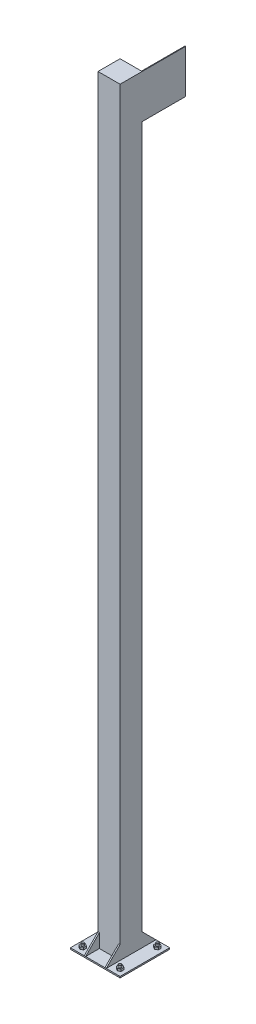
from build123d import *

# Parameters (mm, degrees)
CROQUIS1_W               = 101.6
CROQUIS1_H               = 101.6
CROQUIS1_W_2             = 95.6
CROQUIS1_H_2             = 95.6
SALIENTE_EXTRUIR1_DEPTH  = 3500
CROQUIS2_W               = 228.6
CROQUIS2_H               = 228.6
SALIENTE_EXTRUIR2_DEPTH  = 6.35
SALIENTE_EXTRUIR5_DEPTH  = 6.35
SALIENTE_EXTRUIR6_DEPTH  = 6.35
CROQUIS7_R               = 6.35
SALIENTE_EXTRUIR7_DEPTH  = 20
CROQUIS8_R               = 6.35
SALIENTE_EXTRUIR8_DEPTH  = 10
CHAFL_N1_SIZE            = 1
CROQUIS9_W               = 95.6
CROQUIS9_H               = 95.6
SALIENTE_EXTRUIR9_DEPTH  = 3
CROQUIS10_W              = 200
CROQUIS10_H              = 200
SALIENTE_EXTRUIR10_DEPTH = 3


with BuildPart() as part:
    # Croquis1 → Saliente-Extruir1 (new body)
    with BuildSketch(Plane(origin=(0, 0, 0), x_dir=(1, 0, 0), z_dir=(0, 1, 0))):
        with Locations((50.8, 50.8)):
            Rectangle(CROQUIS1_W, CROQUIS1_H)
        with Locations((50.8, 50.8)):
            Rectangle(CROQUIS1_W_2, CROQUIS1_H_2, mode=Mode.SUBTRACT)
    extrude(amount=SALIENTE_EXTRUIR1_DEPTH)

    # Croquis2 → Saliente-Extruir2 (add)
    with BuildSketch(Plane.XZ):
        with Locations((50.8, -50.8)):
            Rectangle(CROQUIS2_W, CROQUIS2_H)
    extrude(amount=-SALIENTE_EXTRUIR2_DEPTH)

    # Croquis5 → Saliente-Extruir5 (add)
    with BuildSketch(Plane.ZY):
        Polygon((-101.6, 6.35), (-165.1, 6.35), (-101.6, 69.85), align=None)
        Polygon((63.5, 6.35), (0, 6.35), (0, 69.85), align=None)
    extrude(amount=-SALIENTE_EXTRUIR5_DEPTH)

    # Croquis6 → Saliente-Extruir6 (add)
    with BuildSketch(Plane(origin=(101.6, 0, 0), x_dir=(0, 0, -1), z_dir=(1, 0, 0))):
        Polygon((0, 69.85), (-63.5, 6.35), (0, 6.35), align=None)
        Polygon((101.6, 69.85), (165.1, 6.35), (101.6, 6.35), align=None)
    extrude(amount=-SALIENTE_EXTRUIR6_DEPTH)

    # Croquis7 → Saliente-Extruir7 (add)
    with BuildSketch(Plane(origin=(0, 6.35, 0), x_dir=(1, 0, 0), z_dir=(0, 1, 0))):
        with Locations(Location((136.815728753, 136.815728753, 0), (0, 0, 90))):
            Circle(CROQUIS7_R)
        with Locations(Location((136.815728753, -35.215728753, 0), (0, 0, 90))):
            Circle(CROQUIS7_R)
        with Locations(Location((-35.215728753, -35.215728753, 0), (0, 0, 90))):
            Circle(CROQUIS7_R)
        with Locations(Location((-35.215728753, 136.815728753, 0), (0, 0, 90))):
            Circle(CROQUIS7_R)
    extrude(amount=SALIENTE_EXTRUIR7_DEPTH)

    # Croquis8 → Saliente-Extruir8 (add)
    # profile 1 of 4: a face of its own
    with BuildSketch(Plane(origin=(0, 6.35, 0), x_dir=(1, 0, 0), z_dir=(0, 1, 0))):
        Polygon((136.815728753, 124.195901838), (147.744819452, 130.505815295), (147.744819452, 143.12564221), (136.815728753, 149.435555667), (125.886638053, 143.12564221), (125.886638053, 130.505815295), align=None)
        with Locations(Location((136.815728753, 136.815728753, 0), (0, 0, 270))):
            Circle(CROQUIS8_R, mode=Mode.SUBTRACT)
    # profile 2 of 4: a face of its own
    with BuildSketch(Plane(origin=(0, 6.35, 0), x_dir=(1, 0, 0), z_dir=(0, 1, 0))):
        Polygon((125.886638053, -28.905815295), (136.815728753, -22.595901838), (147.744819452, -28.905815295), (147.744819452, -41.52564221), (136.815728753, -47.835555667), (125.886638053, -41.52564221), align=None)
        with Locations(Location((136.815728753, -35.215728753, 0), (0, 0, 90))):
            Circle(CROQUIS8_R, mode=Mode.SUBTRACT)
    # profile 3 of 4: a face of its own
    with BuildSketch(Plane(origin=(0, 6.35, 0), x_dir=(1, 0, 0), z_dir=(0, 1, 0))):
        Polygon((-35.215728753, -22.595901838), (-46.144819452, -28.905815295), (-46.144819452, -41.52564221), (-35.215728753, -47.835555667), (-24.286638053, -41.52564221), (-24.286638053, -28.905815295), align=None)
        with Locations(Location((-35.215728753, -35.215728753, 0), (0, 0, 270))):
            Circle(CROQUIS8_R, mode=Mode.SUBTRACT)
    # profile 4 of 4: a face of its own
    with BuildSketch(Plane(origin=(0, 6.35, 0), x_dir=(1, 0, 0), z_dir=(0, 1, 0))):
        Polygon((-24.286638053, 130.505815295), (-35.215728753, 124.195901838), (-46.144819452, 130.505815295), (-46.144819452, 143.12564221), (-35.215728753, 149.435555667), (-24.286638053, 143.12564221), align=None)
        with Locations(Location((-35.215728753, 136.815728753, 0), (0, 0, 90))):
            Circle(CROQUIS8_R, mode=Mode.SUBTRACT)
    extrude(amount=SALIENTE_EXTRUIR8_DEPTH)

    # Chaflán1
    chafl_n1_edges = [part.edges().sort_by_distance(p)[0] for p in [
        (136.815728753, 26.35, -130.465728753),
        (136.815728753, 26.35, 41.565728753),
        (-35.215728753, 26.35, 41.565728753),
        (-35.215728753, 26.35, -130.465728753),
    ]]
    chamfer(chafl_n1_edges, length=CHAFL_N1_SIZE)

    # Croquis9 → Saliente-Extruir9 (add)
    with BuildSketch(Plane(origin=(0, 3500, 0), x_dir=(1, 0, 0), z_dir=(0, 1, 0))):
        with Locations((50.8, 50.8)):
            Rectangle(CROQUIS9_W, CROQUIS9_H)
    extrude(amount=-SALIENTE_EXTRUIR9_DEPTH)

    # Croquis10 → Saliente-Extruir10 (add)
    with BuildSketch(Plane(origin=(101.6, 0, 0), x_dir=(0, 0, -1), z_dir=(1, 0, 0))):
        with Locations((201.6, 3400)):
            Rectangle(CROQUIS10_W, CROQUIS10_H)
    extrude(amount=-SALIENTE_EXTRUIR10_DEPTH)


solid = part.part
